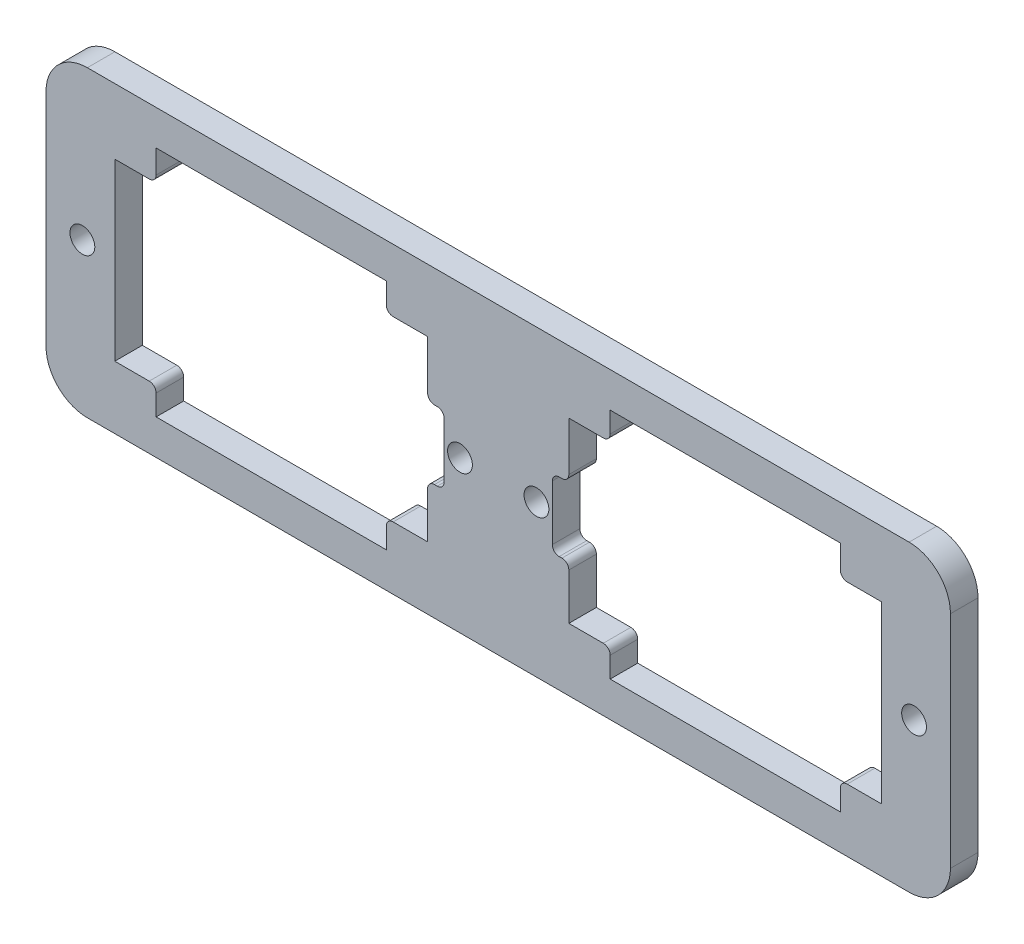
from build123d import *

# Parameters (mm, degrees)
SKETCH_1_R      = 0.9
EXTRUDE_1_DEPTH = 2


with BuildPart() as part:
    # 草图1 → 凸台-拉伸1 (new body)
    with BuildSketch(Plane.XY):
        with BuildLine():
            Line((-29.812520549, 11), (29.812520549, 11))
            ThreePointArc((29.812520549, 11), (31.933840892, 10.121320344), (32.812520549, 8))
            Line((32.812520549, 8), (32.812520549, -8))
            ThreePointArc((32.812520549, -8), (31.933840892, -10.121320344), (29.812520549, -11))
            Line((29.812520549, -11), (-29.812520549, -11))
            ThreePointArc((-29.812520549, -11), (-31.933840892, -10.121320344), (-32.812520549, -8))
            Line((-32.812520549, -8), (-32.812520549, 8))
            ThreePointArc((-32.812520549, 8), (-31.933840892, 10.121320344), (-29.812520549, 11))
        make_face()
        with Locations((2.772967143, 0)):
            Circle(SKETCH_1_R, mode=Mode.SUBTRACT)
        with Locations((30.172967143, 0)):
            Circle(SKETCH_1_R, mode=Mode.SUBTRACT)
        with Locations(Location((-30.172967143, 0, 0), (0, 0, 180))):
            Circle(SKETCH_1_R, mode=Mode.SUBTRACT)
        with Locations(Location((-2.772967143, 0, 0), (0, 0, 180))):
            Circle(SKETCH_1_R, mode=Mode.SUBTRACT)
        with BuildLine():
            Line((4.622967163, 2.40000001), (4.422967163, 2.40000001))
            ThreePointArc((4.422967163, 2.40000001), (4.069413775, 2.253553402), (3.922967167, 1.900000014))
            Line((3.922967167, 1.900000014), (3.922967167, -2.099999986))
            ThreePointArc((3.922967167, -2.099999986), (4.069413775, -2.453553374), (4.422967163, -2.599999982))
            Line((4.422967163, -2.599999982), (4.622967163, -2.599999982))
            ThreePointArc((4.622967163, -2.599999982), (4.976520556, -2.746446592), (5.122967167, -3.099999986))
            Line((5.122967167, -3.099999986), (5.122967167, -6.449999996))
            Line((5.122967167, -6.449999996), (7.622967155, -6.449999996))
            ThreePointArc((7.622967155, -6.449999996), (7.976520542, -6.596446604), (8.12296715, -6.949999991))
            Line((8.12296715, -6.949999991), (8.12296715, -8.45))
            Line((8.12296715, -8.45), (24.822967148, -8.45))
            Line((24.822967148, -8.45), (24.822967148, -6.949999996))
            ThreePointArc((24.822967148, -6.949999996), (24.969413756, -6.596446609), (25.322967143, -6.450000001))
            Line((25.322967143, -6.450000001), (27.822967124, -6.450000001))
            Line((27.822967124, -6.450000001), (27.822967124, 6.250000022))
            Line((27.822967124, 6.250000022), (25.322967143, 6.250000022))
            ThreePointArc((25.322967143, 6.250000022), (24.969413756, 6.39644663), (24.822967148, 6.750000017))
            Line((24.822967148, 6.750000017), (24.822967148, 8.45))
            Line((24.822967148, 8.45), (8.122967152, 8.45))
            Line((8.122967152, 8.45), (8.122967152, 6.949999996))
            ThreePointArc((8.122967152, 6.949999996), (7.976520544, 6.596446609), (7.622967157, 6.450000001))
            Line((7.622967157, 6.450000001), (5.122967167, 6.450000001))
            Line((5.122967167, 6.450000001), (5.122967167, 2.900000014))
            ThreePointArc((5.122967167, 2.900000014), (4.976520556, 2.54644662), (4.622967163, 2.40000001))
        make_face(mode=Mode.SUBTRACT)
        with BuildLine():
            Line((-3.922967167, 1.900000014), (-3.922967167, -2.099999986))
            ThreePointArc((-3.922967167, -2.099999986), (-4.069413775, -2.453553374), (-4.422967163, -2.599999982))
            Line((-4.422967163, -2.599999982), (-4.622967163, -2.599999982))
            ThreePointArc((-4.622967163, -2.599999982), (-4.976520556, -2.746446592), (-5.122967167, -3.099999986))
            Line((-5.122967167, -3.099999986), (-5.122967167, -6.449999996))
            Line((-5.122967167, -6.449999996), (-7.622967155, -6.449999996))
            ThreePointArc((-7.622967155, -6.449999996), (-7.976520542, -6.596446604), (-8.12296715, -6.949999991))
            Line((-8.12296715, -6.949999991), (-8.12296715, -8.45))
            Line((-8.12296715, -8.45), (-24.822967148, -8.45))
            Line((-24.822967148, -8.45), (-24.822967148, -6.949999996))
            ThreePointArc((-24.822967148, -6.949999996), (-24.969413756, -6.596446609), (-25.322967143, -6.450000001))
            Line((-25.322967143, -6.450000001), (-27.822967124, -6.450000001))
            Line((-27.822967124, -6.450000001), (-27.822967124, 6.250000022))
            Line((-27.822967124, 6.250000022), (-25.322967143, 6.250000022))
            ThreePointArc((-25.322967143, 6.250000022), (-24.969413756, 6.39644663), (-24.822967148, 6.750000017))
            Line((-24.822967148, 6.750000017), (-24.822967148, 8.45))
            Line((-24.822967148, 8.45), (-8.122967152, 8.45))
            Line((-8.122967152, 8.45), (-8.122967152, 6.949999996))
            ThreePointArc((-8.122967152, 6.949999996), (-7.976520544, 6.596446609), (-7.622967157, 6.450000001))
            Line((-7.622967157, 6.450000001), (-5.122967167, 6.450000001))
            Line((-5.122967167, 6.450000001), (-5.122967167, 2.900000014))
            ThreePointArc((-5.122967167, 2.900000014), (-4.976520556, 2.54644662), (-4.622967163, 2.40000001))
            Line((-4.622967163, 2.40000001), (-4.422967163, 2.40000001))
            ThreePointArc((-4.422967163, 2.40000001), (-4.069413775, 2.253553402), (-3.922967167, 1.900000014))
        make_face(mode=Mode.SUBTRACT)
    extrude(amount=EXTRUDE_1_DEPTH)


solid = part.part
